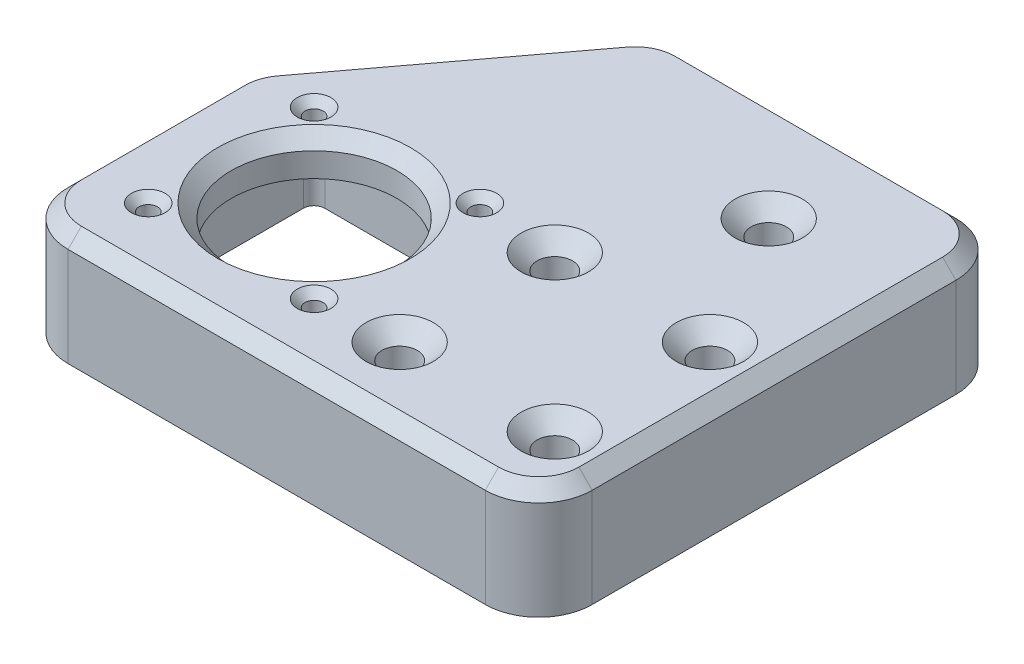
from build123d import *

# Parameters (mm, degrees)
SKETCH_1_W                 = 80
SKETCH_1_H                 = 80
EXTRUDE_278_DEPTH          = 21
EXTRUDE_2_DEPTH            = 21
HOLE_WIZARD_M6_D           = 6.6
HOLE_WIZARD_M6_CSINK_D     = 12.6
HOLE_WIZARD_M6_CSINK_ANGLE = 90
SKETCH_10_W                = 40
SKETCH_10_H                = 40
CUT_EXTRUDE_40_DEPTH       = 11.5
SKETCH_11_W                = 42.3
SKETCH_11_H                = 42.3
NEMA17_DEPTH               = 14
NEMA17_M3_D                = 3.4
NEMA17_M3_CSINK_D          = 6.3
NEMA17_M3_CSINK_ANGLE      = 90
FILLET_1_R                 = 2
SKETCH_14_R                = 15.5
NEMA23_DEPTH               = 106.588825166
SKETCH_2_W                 = 35
SKETCH_2_H                 = 88
CUT_EXTRUDE_4518_DEPTH     = 107.742681248
CUT_EXTRUDE_1_DEPTH        = 107.742681248
FILLET_2_R                 = 10
CHAMFER_1_SIZE             = 2.5


with BuildPart() as part:
    # Эскиз1 → Extrude 278 (new body)
    with BuildSketch(Plane(origin=(0, 0, 0), x_dir=(1, 0, 0), z_dir=(0, 1, 0))):
        Rectangle(SKETCH_1_W, SKETCH_1_H)
    extrude(amount=EXTRUDE_278_DEPTH)

    # Эскиз9 → База-2 (add)
    with BuildSketch(Plane(origin=(0, 21, 0), x_dir=(1, 0, 0), z_dir=(0, 1, 0))):
        Polygon((40, -40), (-40, -40), (-40, 40), (-93, 40), (-93, -48), (40, -48), align=None)
    extrude(amount=-EXTRUDE_2_DEPTH)

    # Крепление-M6 (through all)
    with Locations(Plane(origin=(0, 21, 0), x_dir=(1, 0, 0), z_dir=(0, 1, 0))):
        with Locations((20, -20), (-20, 20), (-34.5, -5.5), (-5.5, -5.5), (-5.5, -34.5), (-34.5, -34.5)):
            CounterSinkHole(HOLE_WIZARD_M6_D / 2, HOLE_WIZARD_M6_CSINK_D / 2, counter_sink_angle=HOLE_WIZARD_M6_CSINK_ANGLE)

    # Эскиз10 → Профиль-40 (cut)
    with BuildSketch(Plane.XZ):
        with Locations((-20, 20)):
            Rectangle(SKETCH_10_W, SKETCH_10_H)
    extrude(amount=-CUT_EXTRUDE_40_DEPTH, mode=Mode.SUBTRACT)

    # Эскиз11 → Nema17 (cut)
    with BuildSketch(Plane.XZ):
        with Locations((-65, 20)):
            Rectangle(SKETCH_11_W, SKETCH_11_H)
    extrude(amount=-NEMA17_DEPTH, mode=Mode.SUBTRACT)

    # Nema17-M3 (through all)
    with Locations(Plane(origin=(0, 21, 0), x_dir=(-1, 0, 0), z_dir=(0, 1, 0))):
        with Locations((80.5, 35.5), (49.5, 35.5), (49.5, 4.5), (80.5, 4.5)):
            CounterSinkHole(NEMA17_M3_D / 2, NEMA17_M3_CSINK_D / 2, counter_sink_angle=NEMA17_M3_CSINK_ANGLE)

    # Скругление1
    fillet_1_edges = [part.edges().sort_by_distance(p)[0] for p in [
        (-40, 5.75, 0),
        (-40, 5.75, 40),
        (0, 5.75, 40),
        (0, 5.75, 0),
        (-43.85, 7, 41.15),
        (-43.85, 7, -1.15),
        (-86.15, 7, -1.15),
        (-86.15, 7, 41.15),
    ]]
    fillet(fillet_1_edges, radius=FILLET_1_R)

    # Эскиз14 → Вырез-Nema23 (cut, through all)
    with BuildSketch(Plane.XZ.offset(-14)):
        with Locations(Location((-65, 20, 0), (0, 0, 270))):
            Circle(SKETCH_14_R)
    extrude(amount=-NEMA23_DEPTH, mode=Mode.SUBTRACT)

    # Эскиз2 → Cut-Extrude 4518 (cut, through all)
    with BuildSketch(Plane(origin=(0, 21, 0), x_dir=(1, 0, 0), z_dir=(0, 1, 0))):
        with Locations((22.5, -4)):
            Rectangle(SKETCH_2_W, SKETCH_2_H)
    extrude(amount=-CUT_EXTRUDE_4518_DEPTH, mode=Mode.SUBTRACT)

    # Эскиз15 → Вырез-Вытянуть1 (cut, through all)
    with BuildSketch(Plane(origin=(0, 21, 0), x_dir=(1, 0, 0), z_dir=(0, 1, 0))):
        Polygon((-93, -4), (-60, 40), (-93, 40), align=None)
    extrude(amount=-CUT_EXTRUDE_1_DEPTH, mode=Mode.SUBTRACT)

    # Скругление2
    fillet_2_edges = [part.edges().sort_by_distance(p)[0] for p in [
        (-93, 10.5, 48),
        (5, 10.5, 48),
        (5, 10.5, -40),
        (-93, 10.5, 4),
        (-60, 10.5, -40),
    ]]
    fillet(fillet_2_edges, radius=FILLET_2_R)

    # Фаска1
    chamfer_1_edges = [part.edges().sort_by_distance(p)[0] for p in [
        (-65, 21, 35.5),
        (-77, 21, -17.333333333),
        (-93, 21, 22.666666667),
        (-44, 21, 48),
        (5, 21, 4),
        (-30, 21, -40),
        (-90.071067812, 21, 45.071067812),
        (2.071067812, 21, 45.071067812),
        (2.071067812, 21, -37.071067812),
        (-59.472135955, 21, -38.94427191),
        (-92.486832981, 21, 4.171055673),
    ]]
    chamfer(chamfer_1_edges, length=CHAMFER_1_SIZE)


solid = part.part
